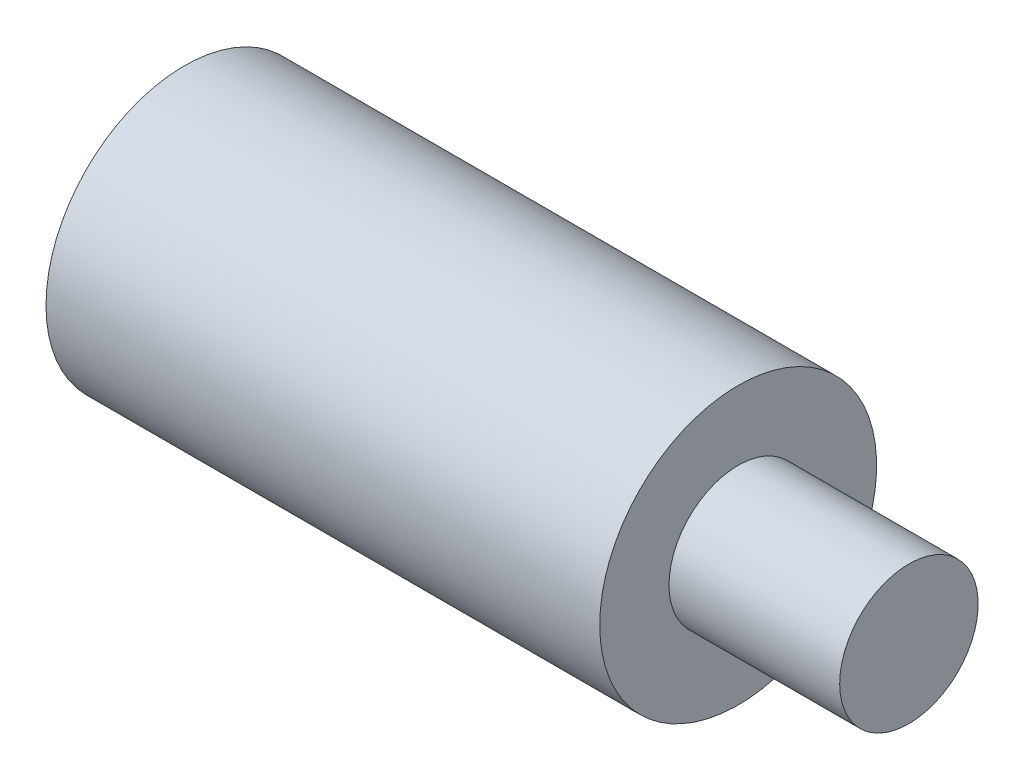
from build123d import *

# Parameters (mm, degrees)
CHAMFER_1_SIZE = 0.4


with BuildPart() as part:
    # Эскиз1 → Revolve 365 (revolve)
    with BuildSketch(Plane.XY, mode=Mode.PRIVATE) as revolve_365_sk:
        Polygon((7.2, -1.5), (7.2, 0), (0.3, 0), (-0.5, -1.2), (-8.5, -1.2), (-8.5, -3), (3.5, -3), (3.5, -1.5), align=None)
    revolve(revolve_365_sk.sketch.rotate(Axis((-97.089355169, 0, 0), (1, 0, 0)), 270), axis=Axis((-97.089355169, 0, 0), (1, 0, 0)))

    # Фаска1
    chamfer_1_edges = [part.edges().sort_by_distance(p)[0] for p in [
        (-8.5, 0, -1.2),
    ]]
    chamfer(chamfer_1_edges, length=CHAMFER_1_SIZE)


solid = part.part
